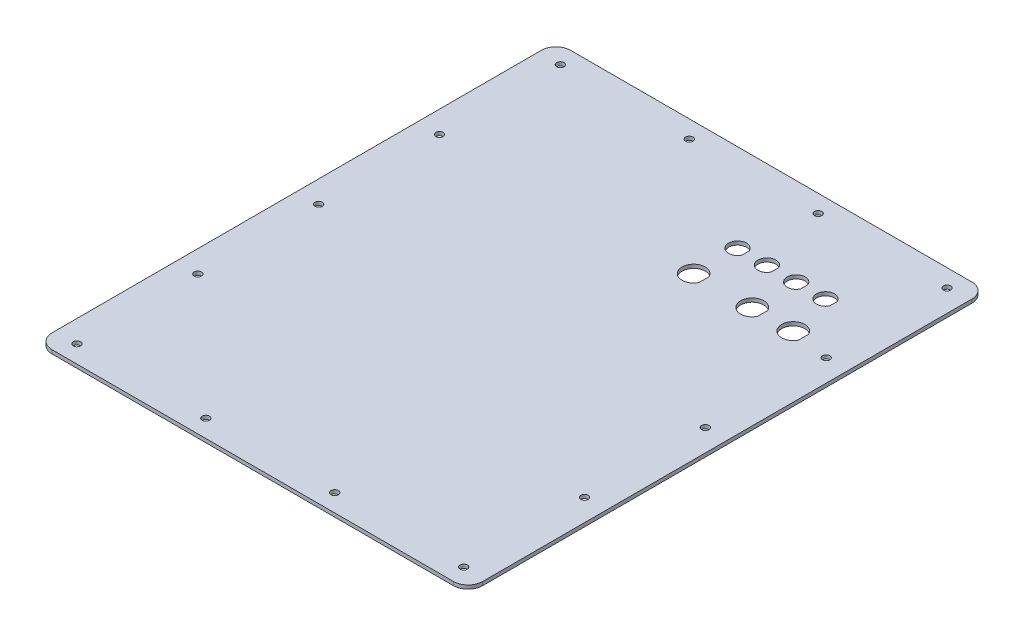
from build123d import *

# Parameters (mm, degrees)
SKETCH1_W            = 373.38
SKETCH1_H            = 449.58
BOSS_EXTRUDE1_DEPTH  = 1.5875
FILLET1_R            = 12.7
SKETCH2_R            = 3.175
CUT_EXTRUDE1_DEPTH   = 293.222142941
LPATTERN1_COUNT      = 4
LPATTERN1_PITCH      = 111.76
LPATTERN1_COUNT_DIR2 = 5
LPATTERN1_PITCH_DIR2 = 104.775
CUT_EXTRUDE2_DEPTH   = 303.544238838


with BuildPart() as part:
    # Sketch1 → Boss-Extrude1 (new, symmetric)
    with BuildSketch(Plane(origin=(0, 0, 0), x_dir=(1, 0, 0), z_dir=(0, 1, 0))):
        Rectangle(SKETCH1_W, SKETCH1_H)
    extrude(amount=BOSS_EXTRUDE1_DEPTH, both=True)

    # Fillet1
    fillet1_edges = [part.edges().sort_by_distance(p)[0] for p in [
        (186.69, 0, 224.79),
        (-186.69, 0, 224.79),
        (-186.69, 0, -224.79),
        (186.69, 0, -224.79),
    ]]
    fillet(fillet1_edges, radius=FILLET1_R)

    # Sketch2 → Cut-Extrude1 (cut, through all)
    with BuildSketch(Plane(origin=(0, 1.5875, 0), x_dir=(1, 0, 0), z_dir=(0, 1, 0))):
        with Locations(Location((-167.64, 209.55, 0), (0, 0, 270))):
            Circle(SKETCH2_R)
    cut_extrude1 = extrude(amount=-CUT_EXTRUDE1_DEPTH, mode=Mode.SUBTRACT)

    # LPattern1: Cut-Extrude1 4 × 5, 6 skipped
    with Locations(*[(i * LPATTERN1_PITCH, 0, j * LPATTERN1_PITCH_DIR2) for i in range(LPATTERN1_COUNT) for j in range(LPATTERN1_COUNT_DIR2) if (i, j) not in ((0, 0), (1, 1), (1, 2), (1, 3), (2, 1), (2, 2), (2, 3))]):
        add(cut_extrude1, mode=Mode.SUBTRACT)

    # Sketch3 → Cut-Extrude2 (cut, through all)
    with BuildSketch(Plane(origin=(13.560082756, 17.4625, -1.196765785), x_dir=(1, 0, 0), z_dir=(0, 1, 0))):
        with BuildLine():
            ThreePointArc((128.806917244, 113.692643266), (109.756917244, 109.293234215), (128.806917244, 104.893825163))
            Line((128.806917244, 104.893825163), (128.806917244, 113.692643266))
        make_face()
        with BuildLine():
            ThreePointArc((116.665717244, 150.635691209), (101.882917244, 147.393234215), (116.665717244, 144.15077722))
            Line((116.665717244, 144.15077722), (116.665717244, 150.635691209))
        make_face()
        with BuildLine():
            ThreePointArc((91.265717244, 150.635691209), (76.482917244, 147.393234215), (91.265717244, 144.15077722))
            Line((91.265717244, 144.15077722), (91.265717244, 150.635691209))
        make_face()
        with BuildLine():
            ThreePointArc((93.246917244, 113.692643266), (74.196917244, 109.293234215), (93.246917244, 104.893825163))
            Line((93.246917244, 104.893825163), (93.246917244, 113.692643266))
        make_face()
        with BuildLine():
            ThreePointArc((65.865717244, 150.635691209), (51.082917244, 147.393234215), (65.865717244, 144.15077722))
            Line((65.865717244, 144.15077722), (65.865717244, 150.635691209))
        make_face()
        with BuildLine():
            ThreePointArc((40.465717244, 150.635691209), (25.682917244, 147.393234215), (40.465717244, 144.15077722))
            Line((40.465717244, 144.15077722), (40.465717244, 150.635691209))
        make_face()
        with BuildLine():
            ThreePointArc((42.446917244, 113.692643266), (23.396917244, 109.293234215), (42.446917244, 104.893825163))
            Line((42.446917244, 104.893825163), (42.446917244, 113.692643266))
        make_face()
    extrude(amount=-CUT_EXTRUDE2_DEPTH, mode=Mode.SUBTRACT)


solid = part.part
